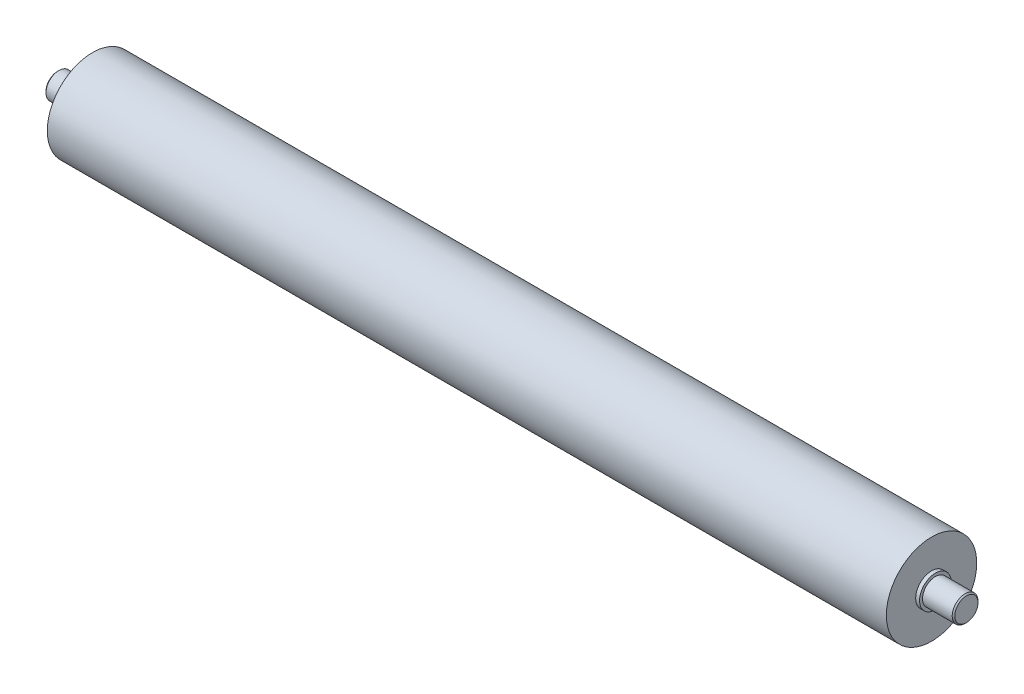
from build123d import *

# Parameters (mm, degrees)
CHAMFER_1_SIZE = 0.5


with BuildPart() as part:
    # 草图1 → 旋转1 (revolve)
    with BuildSketch(Plane(origin=(0, 0, 0), x_dir=(1, 0, 0), z_dir=(0, 1, 0)), mode=Mode.PRIVATE) as revolve_1_sk:
        Polygon((-176, 0), (176, 0), (176, 5), (164, 5), (164, 6.15), (162.5, 6.15), (162.5, 17.5), (-162.5, 17.5), (-162.5, 6.15), (-164, 6.15), (-164, 5), (-176, 5), align=None)
    revolve(revolve_1_sk.sketch.rotate(Axis((-176, 0, 0), (1, 0, 0)), 180), axis=Axis((-176, 0, 0), (1, 0, 0)))

    # 倒角1
    chamfer_1_edges = [part.edges().sort_by_distance(p)[0] for p in [
        (176, 0, -5),
        (-176, 0, -5),
    ]]
    chamfer(chamfer_1_edges, length=CHAMFER_1_SIZE)


solid = part.part
